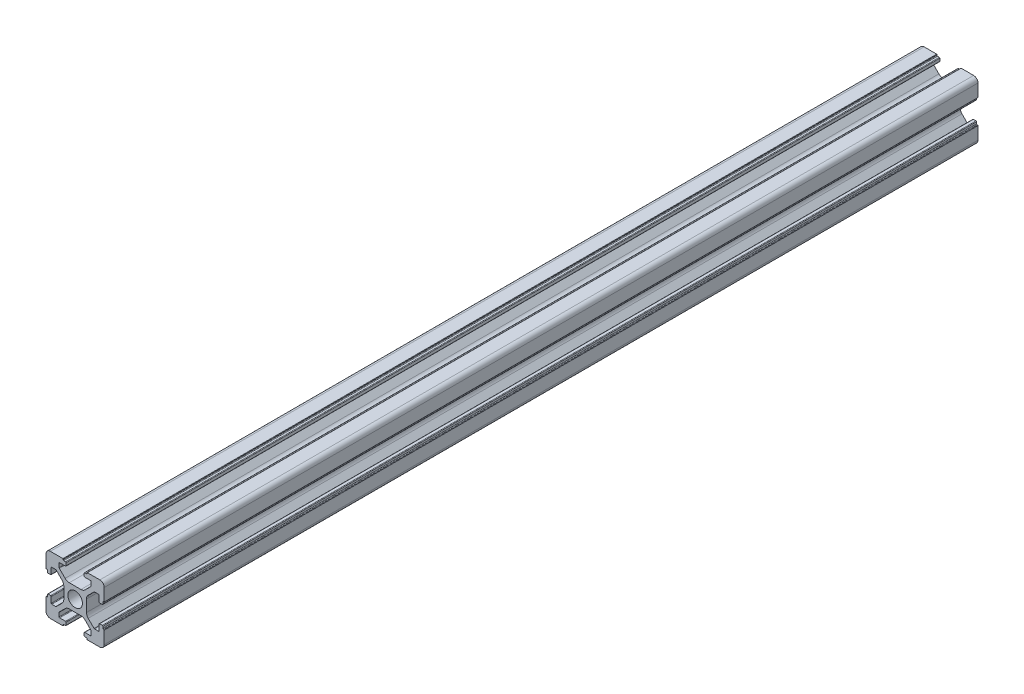
from build123d import *

# Parameters (mm, degrees)
SKETCH1_R           = 2.5
BOSS_EXTRUDE1_DEPTH = 300


with BuildPart() as part:
    # Sketch1 → Boss-Extrude1 (new body)
    with BuildSketch(Plane(origin=(0, 0, 0), x_dir=(1, 0, 0), z_dir=(0, 0, -1))):
        with BuildLine():
            Line((1.5, 0), (5.8, 0))
            ThreePointArc((5.8, 0), (5.870710678, 0.029289322), (5.9, 0.1))
            Line((5.9, 0.1), (5.9, 0.3))
            ThreePointArc((5.9, 0.3), (5.958578644, 0.441421356), (6.1, 0.5))
            Line((6.1, 0.5), (6.7, 0.5))
            ThreePointArc((6.7, 0.5), (6.841421356, 0.558578644), (6.9, 0.7))
            Line((6.9, 0.7), (6.9, 1.6))
            ThreePointArc((6.9, 1.6), (6.841421356, 1.741421356), (6.7, 1.8))
            Line((6.7, 1.8), (4.7, 1.8))
            ThreePointArc((4.7, 1.8), (4.558578644, 1.858578644), (4.5, 2))
            Line((4.5, 2), (4.5, 3.31507576))
            ThreePointArc((4.5, 3.31507576), (4.52283614, 3.429880789), (4.587867966, 3.527207794))
            Line((4.587867966, 3.527207794), (6.574873734, 5.514213562))
            ThreePointArc((6.574873734, 5.514213562), (7.223720432, 5.947759065), (7.989087297, 6.1))
            Line((7.989087297, 6.1), (12.010912703, 6.1))
            ThreePointArc((12.010912703, 6.1), (12.776279568, 5.947759065), (13.425126266, 5.514213562))
            Line((13.425126266, 5.514213562), (15.412132034, 3.527207794))
            ThreePointArc((15.412132034, 3.527207794), (15.47716386, 3.429880789), (15.5, 3.31507576))
            Line((15.5, 3.31507576), (15.5, 2))
            ThreePointArc((15.5, 2), (15.441421356, 1.858578644), (15.3, 1.8))
            Line((15.3, 1.8), (13.3, 1.8))
            ThreePointArc((13.3, 1.8), (13.158578644, 1.741421356), (13.1, 1.6))
            Line((13.1, 1.6), (13.1, 0.7))
            ThreePointArc((13.1, 0.7), (13.158578644, 0.558578644), (13.3, 0.5))
            Line((13.3, 0.5), (13.9, 0.5))
            ThreePointArc((13.9, 0.5), (14.041421356, 0.441421356), (14.1, 0.3))
            Line((14.1, 0.3), (14.1, 0.1))
            ThreePointArc((14.1, 0.1), (14.129289322, 0.029289322), (14.2, 0))
            Line((14.2, 0), (18.5, 0))
            ThreePointArc((18.5, 0), (19.560660172, 0.439339828), (20, 1.5))
            Line((20, 1.5), (20, 5.8))
            ThreePointArc((20, 5.8), (19.970710678, 5.870710678), (19.9, 5.9))
            Line((19.9, 5.9), (19.7, 5.9))
            ThreePointArc((19.7, 5.9), (19.558578644, 5.958578644), (19.5, 6.1))
            Line((19.5, 6.1), (19.5, 6.7))
            ThreePointArc((19.5, 6.7), (19.441421356, 6.841421356), (19.3, 6.9))
            Line((19.3, 6.9), (18.4, 6.9))
            ThreePointArc((18.4, 6.9), (18.258578644, 6.841421356), (18.2, 6.7))
            Line((18.2, 6.7), (18.2, 4.7))
            ThreePointArc((18.2, 4.7), (18.141421356, 4.558578644), (18, 4.5))
            Line((18, 4.5), (16.68492424, 4.5))
            ThreePointArc((16.68492424, 4.5), (16.570119211, 4.52283614), (16.472792206, 4.587867966))
            Line((16.472792206, 4.587867966), (14.485786438, 6.574873734))
            ThreePointArc((14.485786438, 6.574873734), (14.052240935, 7.223720432), (13.9, 7.989087297))
            Line((13.9, 7.989087297), (13.9, 12.010912703))
            ThreePointArc((13.9, 12.010912703), (14.052240935, 12.776279568), (14.485786438, 13.425126266))
            Line((14.485786438, 13.425126266), (16.472792206, 15.412132034))
            ThreePointArc((16.472792206, 15.412132034), (16.570119211, 15.47716386), (16.68492424, 15.5))
            Line((16.68492424, 15.5), (18, 15.5))
            ThreePointArc((18, 15.5), (18.141421356, 15.441421356), (18.2, 15.3))
            Line((18.2, 15.3), (18.2, 13.3))
            ThreePointArc((18.2, 13.3), (18.258578644, 13.158578644), (18.4, 13.1))
            Line((18.4, 13.1), (19.3, 13.1))
            ThreePointArc((19.3, 13.1), (19.441421356, 13.158578644), (19.5, 13.3))
            Line((19.5, 13.3), (19.5, 13.9))
            ThreePointArc((19.5, 13.9), (19.558578644, 14.041421356), (19.7, 14.1))
            Line((19.7, 14.1), (19.9, 14.1))
            ThreePointArc((19.9, 14.1), (19.970710678, 14.129289322), (20, 14.2))
            Line((20, 14.2), (20, 18.5))
            ThreePointArc((20, 18.5), (19.560660172, 19.560660172), (18.5, 20))
            Line((18.5, 20), (14.2, 20))
            ThreePointArc((14.2, 20), (14.129289322, 19.970710678), (14.1, 19.9))
            Line((14.1, 19.9), (14.1, 19.7))
            ThreePointArc((14.1, 19.7), (14.041421356, 19.558578644), (13.9, 19.5))
            Line((13.9, 19.5), (13.3, 19.5))
            ThreePointArc((13.3, 19.5), (13.158578644, 19.441421356), (13.1, 19.3))
            Line((13.1, 19.3), (13.1, 18.4))
            ThreePointArc((13.1, 18.4), (13.158578644, 18.258578644), (13.3, 18.2))
            Line((13.3, 18.2), (15.3, 18.2))
            ThreePointArc((15.3, 18.2), (15.441421356, 18.141421356), (15.5, 18))
            Line((15.5, 18), (15.5, 16.68492424))
            ThreePointArc((15.5, 16.68492424), (15.47716386, 16.570119211), (15.412132034, 16.472792206))
            Line((15.412132034, 16.472792206), (13.425126266, 14.485786438))
            ThreePointArc((13.425126266, 14.485786438), (12.776279568, 14.052240935), (12.010912703, 13.9))
            Line((12.010912703, 13.9), (7.989087297, 13.9))
            ThreePointArc((7.989087297, 13.9), (7.223720432, 14.052240935), (6.574873734, 14.485786438))
            Line((6.574873734, 14.485786438), (4.587867966, 16.472792206))
            ThreePointArc((4.587867966, 16.472792206), (4.52283614, 16.570119211), (4.5, 16.68492424))
            Line((4.5, 16.68492424), (4.5, 18))
            ThreePointArc((4.5, 18), (4.558578644, 18.141421356), (4.7, 18.2))
            Line((4.7, 18.2), (6.7, 18.2))
            ThreePointArc((6.7, 18.2), (6.841421356, 18.258578644), (6.9, 18.4))
            Line((6.9, 18.4), (6.9, 19.3))
            ThreePointArc((6.9, 19.3), (6.841421356, 19.441421356), (6.7, 19.5))
            Line((6.7, 19.5), (6.1, 19.5))
            ThreePointArc((6.1, 19.5), (5.958578644, 19.558578644), (5.9, 19.7))
            Line((5.9, 19.7), (5.9, 19.9))
            ThreePointArc((5.9, 19.9), (5.870710678, 19.970710678), (5.8, 20))
            Line((5.8, 20), (1.5, 20))
            ThreePointArc((1.5, 20), (0.439339828, 19.560660172), (0, 18.5))
            Line((0, 18.5), (0, 14.2))
            ThreePointArc((0, 14.2), (0.029289322, 14.129289322), (0.1, 14.1))
            Line((0.1, 14.1), (0.3, 14.1))
            ThreePointArc((0.3, 14.1), (0.441421356, 14.041421356), (0.5, 13.9))
            Line((0.5, 13.9), (0.5, 13.3))
            ThreePointArc((0.5, 13.3), (0.558578644, 13.158578644), (0.7, 13.1))
            Line((0.7, 13.1), (1.6, 13.1))
            ThreePointArc((1.6, 13.1), (1.741421356, 13.158578644), (1.8, 13.3))
            Line((1.8, 13.3), (1.8, 15.3))
            ThreePointArc((1.8, 15.3), (1.858578644, 15.441421356), (2, 15.5))
            Line((2, 15.5), (3.31507576, 15.5))
            ThreePointArc((3.31507576, 15.5), (3.429880789, 15.47716386), (3.527207794, 15.412132034))
            Line((3.527207794, 15.412132034), (5.514213562, 13.425126266))
            ThreePointArc((5.514213562, 13.425126266), (5.947759065, 12.776279568), (6.1, 12.010912703))
            Line((6.1, 12.010912703), (6.1, 7.989087297))
            ThreePointArc((6.1, 7.989087297), (5.947759065, 7.223720432), (5.514213562, 6.574873734))
            Line((5.514213562, 6.574873734), (3.527207794, 4.587867966))
            ThreePointArc((3.527207794, 4.587867966), (3.429880789, 4.52283614), (3.31507576, 4.5))
            Line((3.31507576, 4.5), (2, 4.5))
            ThreePointArc((2, 4.5), (1.858578644, 4.558578644), (1.8, 4.7))
            Line((1.8, 4.7), (1.8, 6.7))
            ThreePointArc((1.8, 6.7), (1.741421356, 6.841421356), (1.6, 6.9))
            Line((1.6, 6.9), (0.7, 6.9))
            ThreePointArc((0.7, 6.9), (0.558578644, 6.841421356), (0.5, 6.7))
            Line((0.5, 6.7), (0.5, 6.1))
            ThreePointArc((0.5, 6.1), (0.441421356, 5.958578644), (0.3, 5.9))
            Line((0.3, 5.9), (0.1, 5.9))
            ThreePointArc((0.1, 5.9), (0.029289322, 5.870710678), (0, 5.8))
            Line((0, 5.8), (0, 1.5))
            ThreePointArc((0, 1.5), (0.439339828, 0.439339828), (1.5, 0))
        make_face()
        with Locations(Location((10, 10, 0), (0, 0, 180))):
            Circle(SKETCH1_R, mode=Mode.SUBTRACT)
    extrude(amount=BOSS_EXTRUDE1_DEPTH)


solid = part.part
